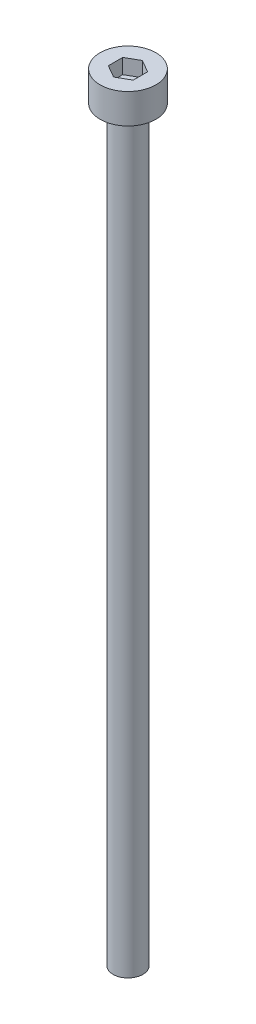
from build123d import *

# Parameters (mm, degrees)
SKETCH_1_R      = 2.8
EXTRUDE_1_DEPTH = 3
EXTRUDE_2_DEPTH = 1.5
SKETCH_2_R      = 1.5
EXTRUDE_3_DEPTH = 75


with BuildPart() as part:
    # 草图1 → 凸台-拉伸1 (new body)
    with BuildSketch(Plane(origin=(0, 0, 0), x_dir=(1, 0, 0), z_dir=(0, 1, 0))):
        Circle(SKETCH_1_R)
        Polygon((1.25, -0.721687836), (1.25, 0.721687836), (0, 1.443375673), (-1.25, 0.721687836), (-1.25, -0.721687836), (0, -1.443375673), align=None, mode=Mode.SUBTRACT)
    extrude(amount=EXTRUDE_1_DEPTH)

    # 草图1<2> → 凸台-拉伸2 (add)
    with BuildSketch(Plane(origin=(0, 0, 0), x_dir=(1, 0, 0), z_dir=(0, 1, 0))):
        Polygon((0, -1.443375673), (1.25, -0.721687836), (1.25, 0.721687836), (0, 1.443375673), (-1.25, 0.721687836), (-1.25, -0.721687836), align=None)
    extrude(amount=EXTRUDE_2_DEPTH)

    # 草图2 → 凸台-拉伸3 (add)
    with BuildSketch(Plane.XZ):
        Circle(SKETCH_2_R)
    extrude(amount=EXTRUDE_3_DEPTH)


solid = part.part
